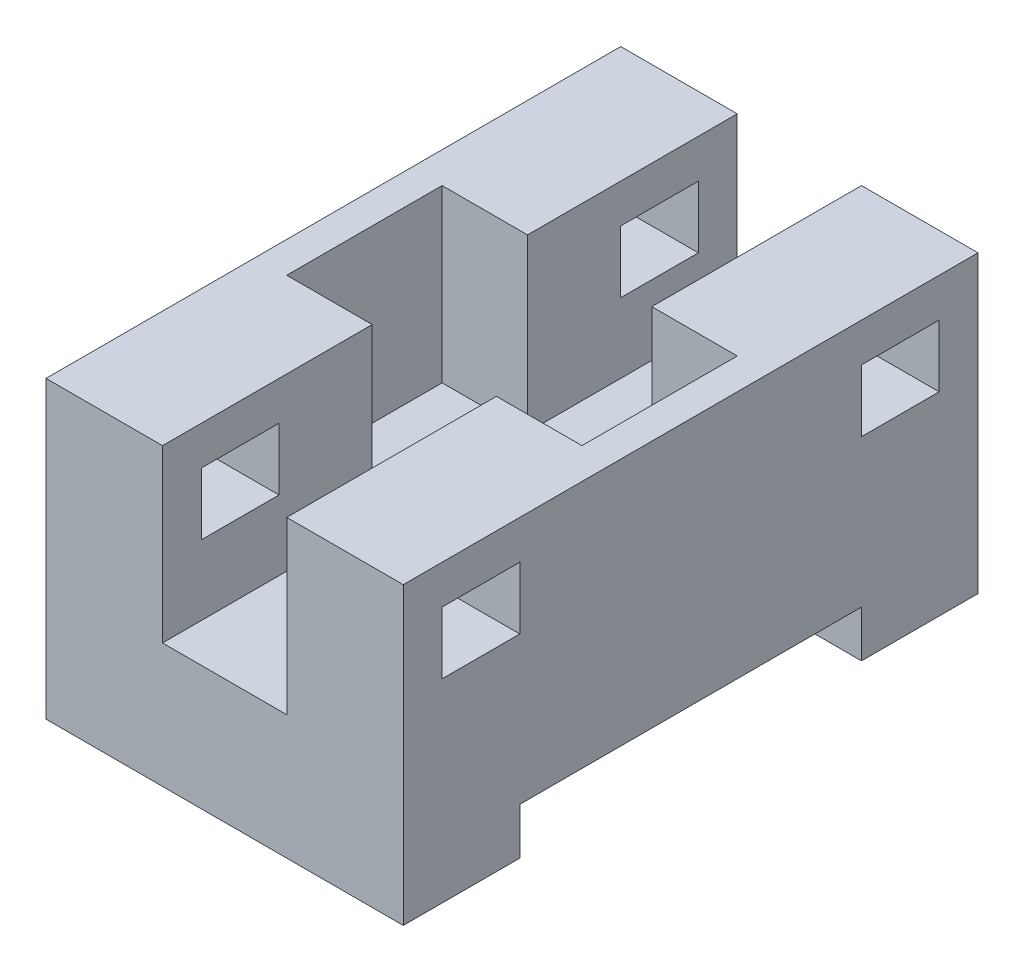
from build123d import *

# Parameters (mm, degrees)
SALIENTE_EXTRUIR1_DEPTH = 23
CORTAR_EXTRUIR1_DEPTH   = 22
CROQUIS3_W              = 10
CROQUIS3_H              = 8
CORTAR_EXTRUIR2_DEPTH   = 63.016126935


with BuildPart() as part:
    # Croquis1 → Saliente-Extruir1 (new, symmetric)
    with BuildSketch(Plane(origin=(0, 0, 0), x_dir=(0, 0, -1), z_dir=(1, 0, 0))):
        Polygon((22, -19), (37, -19), (37, 19), (-37, 19), (-37, -19), (-22, -19), (-22, -13), (22, -13), align=None)
    extrude(amount=SALIENTE_EXTRUIR1_DEPTH, both=True)

    # Croquis2 → Cortar-Extruir1 (cut)
    with BuildSketch(Plane(origin=(0, 19, 0), x_dir=(1, 0, 0), z_dir=(0, 1, 0))):
        Polygon((-8, 37), (8, 37), (8, 10), (19, 10), (19, -10), (8, -10), (8, -37), (-8, -37), (-8, -10), (-19, -10), (-19, 10), (-8, 10), align=None)
    extrude(amount=-CORTAR_EXTRUIR1_DEPTH, mode=Mode.SUBTRACT)

    # Croquis3 → Cortar-Extruir2 (cut, through all)
    with BuildSketch(Plane(origin=(23, 0, 0), x_dir=(0, 0, -1), z_dir=(1, 0, 0))):
        with Locations((27, 10)):
            Rectangle(CROQUIS3_W, CROQUIS3_H)
        with Locations((-27, 10)):
            Rectangle(CROQUIS3_W, CROQUIS3_H)
    extrude(amount=-CORTAR_EXTRUIR2_DEPTH, mode=Mode.SUBTRACT)


solid = part.part
